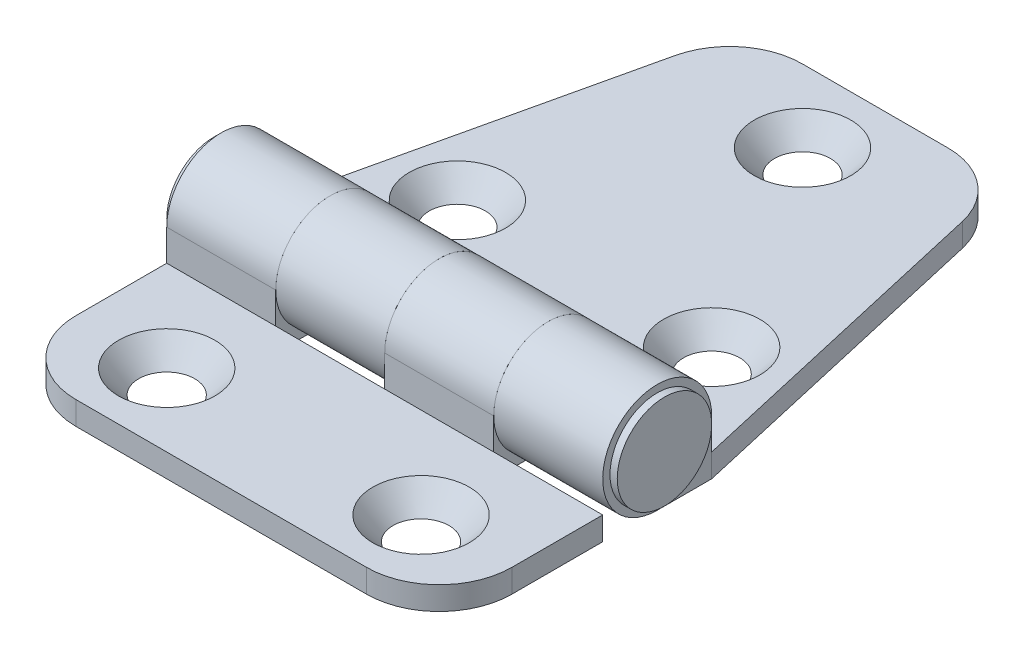
from build123d import *

# Parameters (mm, degrees)
SKETCH1_R                                     = 2.778125
LEFT_LEAF_DEPTH                               = 19.05
CUT_EXTRUDE1_DEPTH                            = 28.358479604
CUT_EXTRUDE1_DEPTH_BACK                       = 28.358479604
SKETCH2_W                                     = 9.525
SKETCH2_H                                     = 9.525
SKETCH3_R                                     = 2.778125
RIGHT_LEAF_DEPTH                              = 19.05
CUT_EXTRUDE2_DEPTH                            = 43.8625
CUT_EXTRUDE2_DEPTH_BACK                       = 43.8625
SKETCH9_W                                     = 9.525
SKETCH9_H                                     = 9.525
SKETCH10_R                                    = 2.778125
EXTRUDE1_DEPTH                                = 19.05
CUT_EXTRUDE3_DEPTH                            = 44.251098818
FILLET1_R                                     = 6.35
FILLET2_R                                     = 6.35
CSK_FOR_8_FLAT_HEAD_MACHINE_SCREW1_AT_2_COUNT = 2
CSK_FOR_8_FLAT_HEAD_MACHINE_SCREW1_AT_2_PITCH = 22.054254833
CSK_FOR_8_FLAT_HEAD_MACHINE_SCREW1_AT_3_COUNT = 2
CSK_FOR_8_FLAT_HEAD_MACHINE_SCREW1_AT_3_PITCH = 22.054254833
CSK_FOR_8_FLAT_HEAD_MACHINE_SCREW1_AT_4_COUNT = 2
CSK_FOR_8_FLAT_HEAD_MACHINE_SCREW1_AT_4_PITCH = 45.818011265
CSK_FOR_8_FLAT_HEAD_MACHINE_SCREW1_AT_5_COUNT = 2
CSK_FOR_8_FLAT_HEAD_MACHINE_SCREW1_AT_5_PITCH = 45.818011265
SKETCH14_W                                    = 0.635
SKETCH14_H                                    = 4.1275


with BuildPart() as part:
    # Sketch1 → Left Leaf (new, symmetric)
    with BuildSketch(Plane(origin=(0, 0, 0), x_dir=(0, 0, -1), z_dir=(1, 0, 0))):
        with BuildLine():
            Line((-4.7625, 0), (-4.7625, -2.7305))
            Line((-4.7625, -2.7305), (-19.05, -2.7305))
            Line((-19.05, -2.7305), (-19.05, -4.7625))
            Line((-19.05, -4.7625), (0, -4.7625))
            ThreePointArc((0, -4.7625), (3.367596045, 3.367596045), (-4.7625, 0))
        make_face()
        with Locations(Location((0, 0, 0), (0, 0, 180))):
            Circle(SKETCH1_R, mode=Mode.SUBTRACT)
    extrude(amount=LEFT_LEAF_DEPTH, both=True)

    # Sketch2 → Cut-Extrude1 (cut, two sides: drawn at the far end of the back side and taken through both)
    with BuildSketch(Plane(origin=(0, 0, 0), x_dir=(1, 0, 0), z_dir=(0, 1, 0)).offset(-CUT_EXTRUDE1_DEPTH_BACK)):
        with Locations((14.2875, 0)):
            Rectangle(SKETCH2_W, SKETCH2_H)
        with Locations((-4.7625, 0)):
            Rectangle(SKETCH2_W, SKETCH2_H)
    extrude(amount=CUT_EXTRUDE1_DEPTH + CUT_EXTRUDE1_DEPTH_BACK, mode=Mode.SUBTRACT)

    # Fillet1
    fillet1_edges = [part.edges().sort_by_distance(p)[0] for p in [
        (19.05, -3.7465, 19.05),
        (-19.05, -3.7465, 19.05),
    ]]
    fillet(fillet1_edges, radius=FILLET1_R)


with BuildPart() as body_2:
    # Sketch3 → Right Leaf (new, symmetric)
    with BuildSketch(Plane(origin=(0, 0, 0), x_dir=(0, 0, -1), z_dir=(1, 0, 0))):
        with BuildLine():
            Line((38.1, -2.7305), (38.1, -4.7625))
            Line((38.1, -4.7625), (0, -4.7625))
            ThreePointArc((0, -4.7625), (-3.367596045, 3.367596045), (4.7625, 0))
            Line((4.7625, 0), (4.7625, -2.7305))
            Line((4.7625, -2.7305), (38.1, -2.7305))
        make_face()
        with Locations(Location((0, 0, 0), (0, 0, 180))):
            Circle(SKETCH3_R, mode=Mode.SUBTRACT)
    extrude(amount=RIGHT_LEAF_DEPTH, both=True)

    # Sketch9 → Cut-Extrude2 (cut, two sides: drawn at the far end of the back side and taken through both)
    with BuildSketch(Plane(origin=(0, 0, 0), x_dir=(1, 0, 0), z_dir=(0, 1, 0)).offset(-CUT_EXTRUDE2_DEPTH_BACK)):
        with Locations((4.7625, 0)):
            Rectangle(SKETCH9_W, SKETCH9_H)
        with Locations((-14.2875, 0)):
            Rectangle(SKETCH9_W, SKETCH9_H)
    extrude(amount=CUT_EXTRUDE2_DEPTH + CUT_EXTRUDE2_DEPTH_BACK, mode=Mode.SUBTRACT)

    # Sketch13 → Cut-Extrude3 (cut, through all)
    with BuildSketch(Plane(origin=(0, -2.7305, 0), x_dir=(-1, 0, 0), z_dir=(0, 1, 0))):
        Polygon((19.05, -4.7625), (11.43, -38.1), (-11.43, -38.1), (-19.05, -4.7625), (-19.05, -46.917728232), (19.05, -46.917728232), align=None)
    extrude(amount=-CUT_EXTRUDE3_DEPTH, mode=Mode.SUBTRACT)

    # Fillet2
    fillet2_edges = [body_2.edges().sort_by_distance(p)[0] for p in [
        (11.43, -3.7465, -38.1),
        (-11.43, -3.7465, -38.1),
    ]]
    fillet(fillet2_edges, radius=FILLET2_R)

    # Sketch12 → CSK for #8 Flat Head Machine Screw1 (revolve, cut)
    with BuildSketch(Plane(origin=(0, -2.7305, -31.75), x_dir=(0, 0, 1), z_dir=(1, 0, 0))):
        Polygon((0, 0), (0, 2.032), (2.2479, 2.032), (2.2479, 2.26450021), (4.2164, 0), align=None)
    csk_for_8_flat_head_machine_screw1 = revolve(axis=Axis((0, 3.6195, -31.75), (0, -1, 0)), mode=Mode.SUBTRACT)

    # CSK for #8 Flat Head Machine Screw1 at 2: CSK for #8 Flat Head Machine Screw1 ×2
    with Locations(*[Vector(-0.5038710255240861, 0, 0.8637789008984336) * (i * CSK_FOR_8_FLAT_HEAD_MACHINE_SCREW1_AT_2_PITCH) for i in range(1, CSK_FOR_8_FLAT_HEAD_MACHINE_SCREW1_AT_2_COUNT)]):
        add(csk_for_8_flat_head_machine_screw1, mode=Mode.SUBTRACT)

    # CSK for #8 Flat Head Machine Screw1 at 3: CSK for #8 Flat Head Machine Screw1 ×2
    with Locations(*[Vector(0.5038710255240861, 0, 0.8637789008984336) * (i * CSK_FOR_8_FLAT_HEAD_MACHINE_SCREW1_AT_3_PITCH) for i in range(1, CSK_FOR_8_FLAT_HEAD_MACHINE_SCREW1_AT_3_COUNT)]):
        add(csk_for_8_flat_head_machine_screw1, mode=Mode.SUBTRACT)


with BuildPart() as body_3:
    # Sketch10 → Extrude1 (new, symmetric)
    with BuildSketch(Plane(origin=(0, 0, 0), x_dir=(0, 0, -1), z_dir=(1, 0, 0))):
        with Locations(Location((0, 0, 0), (0, 0, 180))):
            Circle(SKETCH10_R)
    extrude(amount=EXTRUDE1_DEPTH, both=True)

    # Sketch14 → Revolve1 (revolve)
    with BuildSketch(Plane(origin=(0, 0, 0), x_dir=(-1, 0, 0), z_dir=(0, 1, 0)), mode=Mode.PRIVATE) as revolve1_sk:
        with Locations((-19.3675, -2.06375)):
            Rectangle(SKETCH14_W, SKETCH14_H)
        with Locations((19.3675, -2.06375)):
            Rectangle(SKETCH14_W, SKETCH14_H)
    revolve(revolve1_sk.sketch.rotate(Axis((-19.05, 0, 0), (1, 0, 0)), 180), axis=Axis((-19.05, 0, 0), (1, 0, 0)))


with BuildPart() as part_1:
    add(part.part)

    # CSK for #8 Flat Head Machine Screw1 at 4: CSK for #8 Flat Head Machine Screw1 ×2
    with Locations(*[Vector(-0.242535625036333, 0, 0.970142500145332) * (i * CSK_FOR_8_FLAT_HEAD_MACHINE_SCREW1_AT_4_PITCH) for i in range(1, CSK_FOR_8_FLAT_HEAD_MACHINE_SCREW1_AT_4_COUNT)]):
        add(csk_for_8_flat_head_machine_screw1, mode=Mode.SUBTRACT)

    # CSK for #8 Flat Head Machine Screw1 at 5: CSK for #8 Flat Head Machine Screw1 ×2
    with Locations(*[Vector(0.242535625036333, 0, 0.970142500145332) * (i * CSK_FOR_8_FLAT_HEAD_MACHINE_SCREW1_AT_5_PITCH) for i in range(1, CSK_FOR_8_FLAT_HEAD_MACHINE_SCREW1_AT_5_COUNT)]):
        add(csk_for_8_flat_head_machine_screw1, mode=Mode.SUBTRACT)


solid = Compound([body_2.part, body_3.part, part_1.part])
